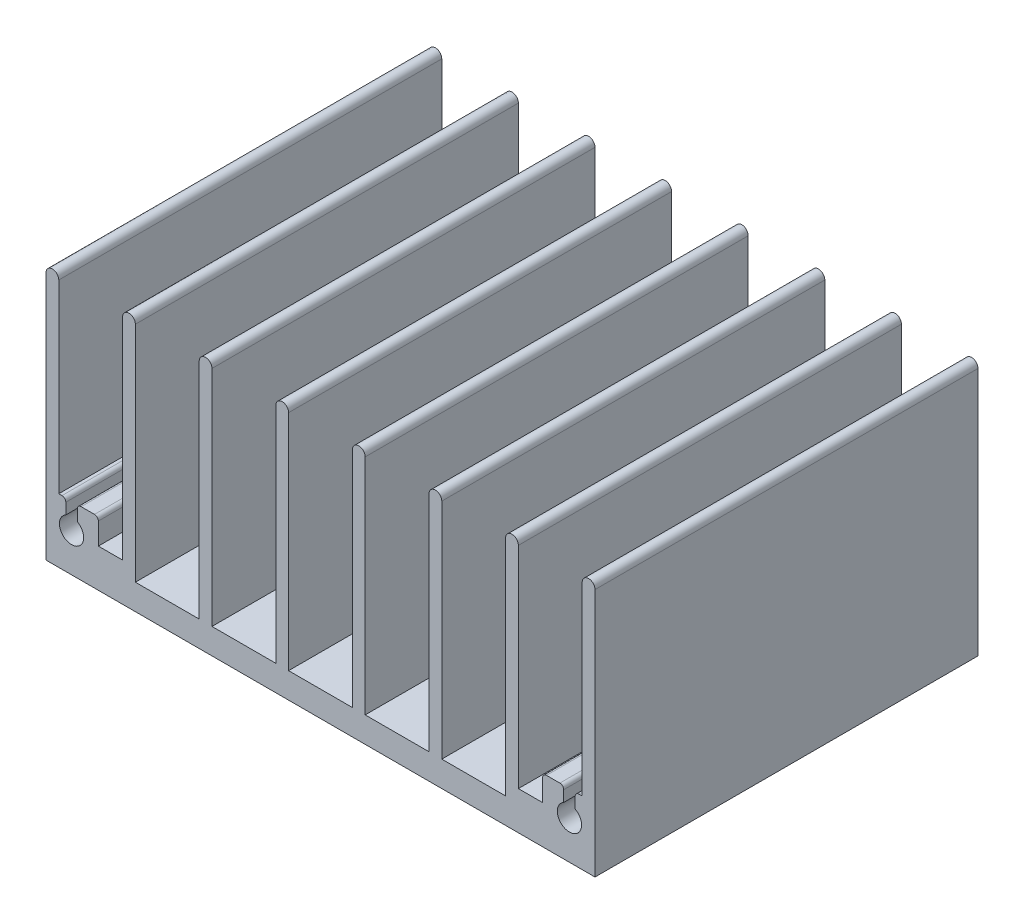
from build123d import *

# Parameters (mm, degrees)
EXTRUDE_1_DEPTH = 30
FILLET_1_R      = 0.3


with BuildPart() as part:
    # Эскиз1 → Бобышка-Вытянуть1 (new body)
    with BuildSketch(Plane.XY):
        with BuildLine():
            Line((21.5, 0), (-21.5, 0))
            Line((-21.5, 0), (-21.5, 19.5))
            ThreePointArc((-21.5, 19.5), (-21, 20), (-20.5, 19.5))
            Line((-20.5, 19.5), (-20.5, 5))
            Line((-20.5, 5), (-19.95, 5))
            Line((-19.95, 5), (-19.95, 3.836660027))
            ThreePointArc((-19.95, 3.836660027), (-19.5, 2.05), (-19.05, 3.836660027))
            Line((-19.05, 3.836660027), (-19.05, 5))
            Line((-19.05, 5), (-17.4, 5))
            Line((-17.4, 5), (-17.4, 3))
            Line((-17.4, 3), (-15.5, 3))
            Line((-15.5, 3), (-15.5, 19.5))
            ThreePointArc((-15.5, 19.5), (-15, 20), (-14.5, 19.5))
            Line((-14.5, 19.5), (-14.5, 2))
            Line((-14.5, 2), (-9.5, 2))
            Line((-9.5, 2), (-9.5, 19.5))
            ThreePointArc((-9.5, 19.5), (-9, 20), (-8.5, 19.5))
            Line((-8.5, 19.5), (-8.5, 2))
            Line((-8.5, 2), (-3.5, 2))
            Line((-3.5, 2), (-3.5, 19.5))
            ThreePointArc((-3.5, 19.5), (-3, 20), (-2.5, 19.5))
            Line((-2.5, 19.5), (-2.5, 2))
            Line((-2.5, 2), (2.5, 2))
            Line((2.5, 2), (2.5, 19.5))
            ThreePointArc((2.5, 19.5), (3, 20), (3.5, 19.5))
            Line((3.5, 19.5), (3.5, 2))
            Line((3.5, 2), (8.5, 2))
            Line((8.5, 2), (8.5, 19.5))
            ThreePointArc((8.5, 19.5), (9, 20), (9.5, 19.5))
            Line((9.5, 19.5), (9.5, 2))
            Line((9.5, 2), (14.5, 2))
            Line((14.5, 2), (14.5, 19.5))
            ThreePointArc((14.5, 19.5), (15, 20), (15.5, 19.5))
            Line((15.5, 19.5), (15.5, 3))
            Line((15.5, 3), (17.4, 3))
            Line((17.4, 3), (17.4, 5))
            Line((17.4, 5), (19.05, 5))
            Line((19.05, 5), (19.05, 3.836660027))
            ThreePointArc((19.05, 3.836660027), (19.5, 2.05), (19.95, 3.836660027))
            Line((19.95, 3.836660027), (19.95, 5))
            Line((19.95, 5), (20.5, 5))
            Line((20.5, 5), (20.5, 19.5))
            ThreePointArc((20.5, 19.5), (21, 20), (21.5, 19.5))
            Line((21.5, 19.5), (21.5, 0))
        make_face()
    extrude(amount=EXTRUDE_1_DEPTH)

    # Скругление1
    fillet_1_edges = [part.edges().sort_by_distance(p)[0] for p in [
        (-19.95, 5, 15),
        (-19.05, 5, 15),
        (-17.4, 5, 15),
        (17.4, 5, 15),
        (19.05, 5, 15),
        (19.95, 5, 15),
    ]]
    fillet(fillet_1_edges, radius=FILLET_1_R)


solid = part.part
